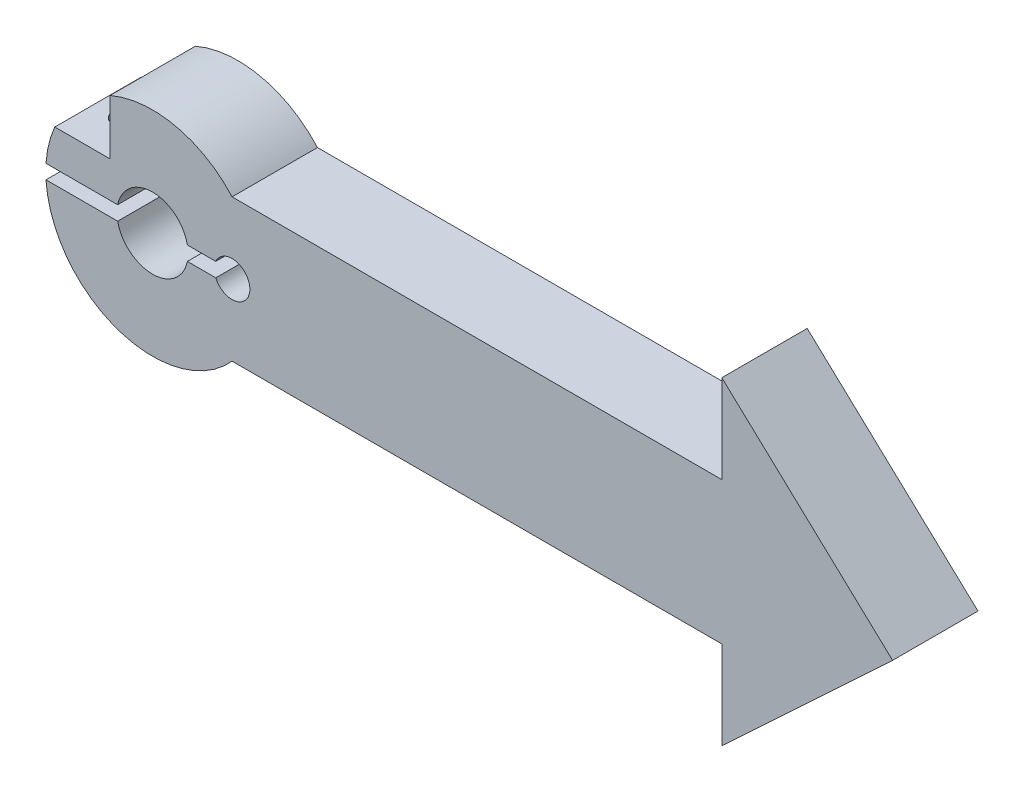
from build123d import *

# Parameters (mm, degrees)
BOSS_EXTRUDE1_DEPTH     = 15.24
CUT_EXTRUDE1_DEPTH      = 136.965704146
CUT_EXTRUDE1_DEPTH_BACK = 136.965704146
SKETCH2_R               = 2.032
SKETCH3_W               = 13.96136878
SKETCH3_H               = 14.958609408
CUT_EXTRUDE2_DEPTH      = 136.965704158


with BuildPart() as part:
    # Sketch1 → Boss-Extrude1 (new body)
    with BuildSketch(Plane.XY):
        with BuildLine():
            Line((14.199031657, -12.7), (101.6, -12.7))
            Line((101.6, -12.7), (101.6, -28.448))
            Line((101.6, -28.448), (132.08, 0))
            Line((132.08, 0), (101.6, 28.448))
            Line((101.6, 28.448), (101.6, 12.7))
            Line((101.6, 12.7), (14.199031657, 12.7))
            ThreePointArc((14.199031657, 12.7), (-6.20014954, 18.012791168), (-19.007619525, 1.27))
            Line((-19.007619525, 1.27), (-6.221703947, 1.27))
            ThreePointArc((-6.221703947, 1.27), (0, 6.35), (6.221703947, 1.27))
            Line((6.221703947, 1.27), (11.289096091, 1.27))
            ThreePointArc((11.289096091, 1.27), (17.374031657, 0), (11.289096091, -1.27))
            Line((11.289096091, -1.27), (6.221703947, -1.27))
            ThreePointArc((6.221703947, -1.27), (0, -6.35), (-6.221703947, -1.27))
            Line((-6.221703947, -1.27), (-19.007619525, -1.27))
            ThreePointArc((-19.007619525, -1.27), (-6.20014954, -18.012791168), (14.199031657, -12.7))
        make_face()
    extrude(amount=BOSS_EXTRUDE1_DEPTH)

    # Sketch2 → Cut-Extrude1 (cut, two sides: drawn at the far end of the back side and taken through both)
    with BuildSketch(Plane(origin=(0, 0, 0), x_dir=(1, 0, 0), z_dir=(0, 1, 0)).offset(-CUT_EXTRUDE1_DEPTH_BACK)):
        with Locations(Location((-12.614661736, -7.62, 0), (0, 0, 270))):
            Circle(SKETCH2_R)
    extrude(amount=CUT_EXTRUDE1_DEPTH + CUT_EXTRUDE1_DEPTH_BACK, mode=Mode.SUBTRACT)

    # Sketch3 → Cut-Extrude2 (cut, through all)
    with BuildSketch(Plane.XY.offset(15.24)):
        with Locations((-14.567066479, 15.158057533)):
            Rectangle(SKETCH3_W, SKETCH3_H)
    extrude(amount=-CUT_EXTRUDE2_DEPTH, mode=Mode.SUBTRACT)


solid = part.part
